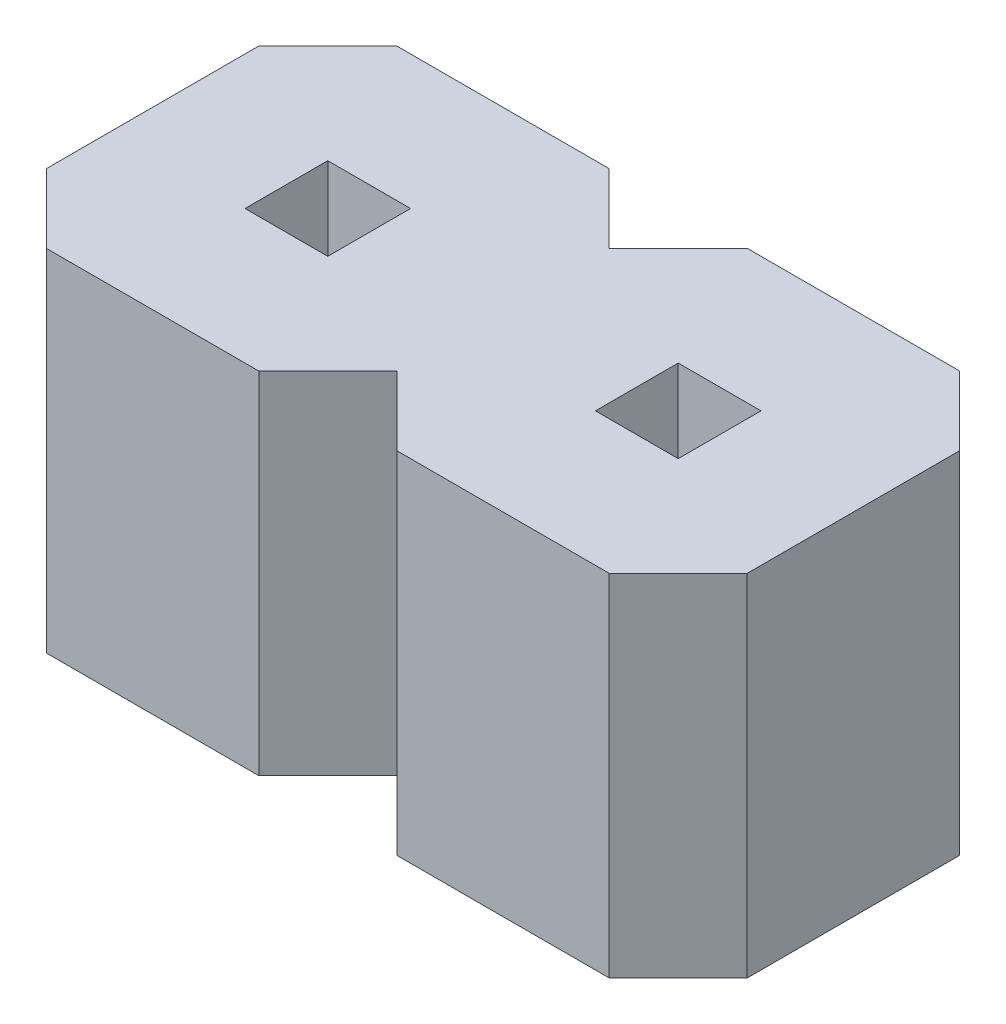
from build123d import *

# Parameters (mm, degrees)
SKETCH1_W           = 0.6
SKETCH1_H           = 0.6
BOSS_EXTRUDE1_DEPTH = 2.54


with BuildPart() as part:
    # Sketch1 → Boss-Extrude1 (new body)
    with BuildSketch(Plane(origin=(0, 0, 0), x_dir=(1, 0, 0), z_dir=(0, 1, 0))):
        Polygon((-0.5, 0), (-2.04, 0), (-2.54, 0.5), (-3.04, 0), (-4.58, 0), (-5.08, 0.5), (-5.08, 2.04), (-4.58, 2.54), (-3.04, 2.54), (-2.54, 2.04), (-2.04, 2.54), (-0.5, 2.54), (0, 2.04), (0, 0.5), align=None)
        with Locations((-3.81, 1.27)):
            Rectangle(SKETCH1_W, SKETCH1_H, mode=Mode.SUBTRACT)
        with Locations((-1.27, 1.27)):
            Rectangle(SKETCH1_W, SKETCH1_H, mode=Mode.SUBTRACT)
    extrude(amount=BOSS_EXTRUDE1_DEPTH)


solid = part.part
